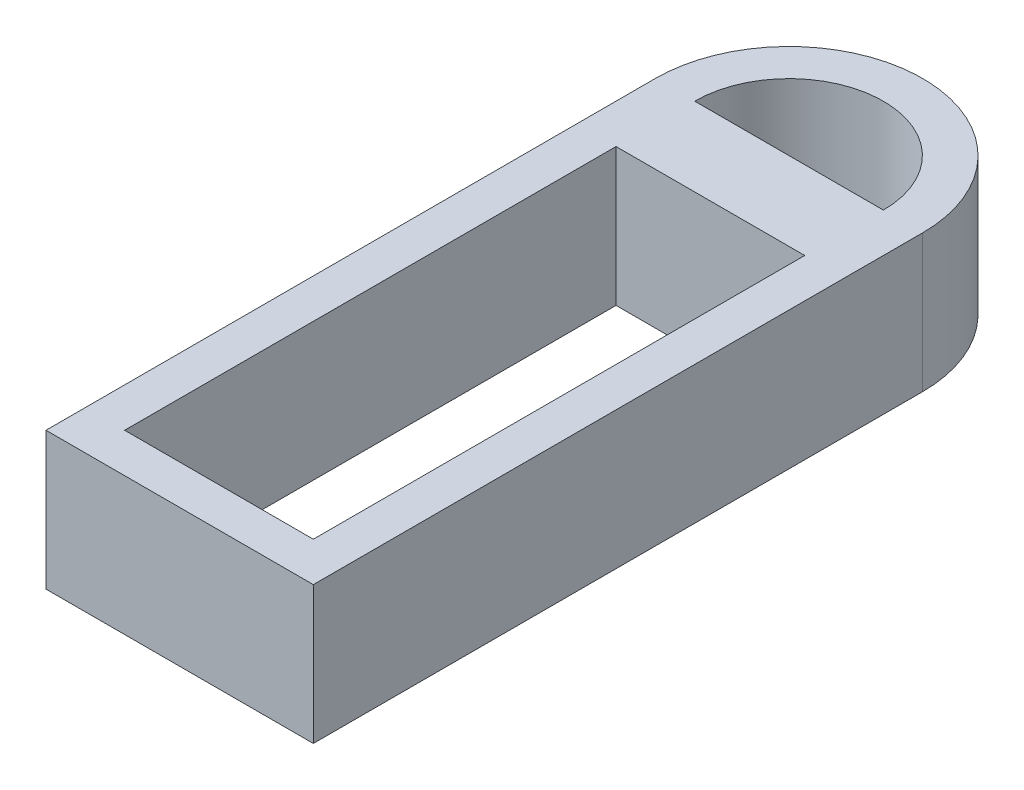
from build123d import *

# Parameters (mm, degrees)
SKETCH1_W           = 6.8
SKETCH1_H           = 14.5
SKETCH1_W_2         = 4.8
SKETCH1_H_2         = 12.5
BOSS_EXTRUDE1_DEPTH = 3.5
BOSS_EXTRUDE2_DEPTH = 3.5


with BuildPart() as part:
    # Sketch1 → Boss-Extrude1 (new body)
    with BuildSketch(Plane(origin=(0, 0, 0), x_dir=(1, 0, 0), z_dir=(0, 1, 0))):
        Rectangle(SKETCH1_W, SKETCH1_H)
        Rectangle(SKETCH1_W_2, SKETCH1_H_2, mode=Mode.SUBTRACT)
    extrude(amount=BOSS_EXTRUDE1_DEPTH)

    # Sketch2 → Boss-Extrude2 (add)
    with BuildSketch(Plane(origin=(0, 3.5, 0), x_dir=(1, 0, 0), z_dir=(0, 1, 0))):
        with BuildLine():
            Line((-3.4, 7.25), (3.4, 7.25))
            Line((3.4, 7.25), (3.4, 8.25))
            ThreePointArc((3.4, 8.25), (0, 11.65), (-3.4, 8.25))
            Line((-3.4, 8.25), (-3.4, 7.25))
        make_face()
        with BuildLine():
            Line((-2.4, 8.25), (2.4, 8.25))
            ThreePointArc((2.4, 8.25), (0, 10.65), (-2.4, 8.25))
        make_face(mode=Mode.SUBTRACT)
    extrude(amount=-BOSS_EXTRUDE2_DEPTH)


solid = part.part
